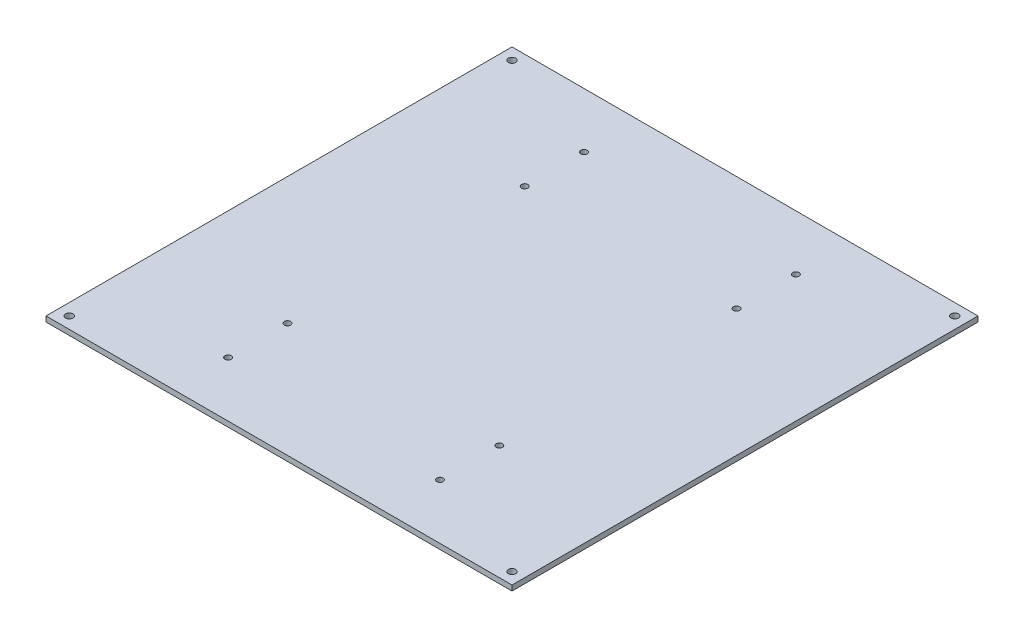
from build123d import *

# Parameters (mm, degrees)
SKETCH_1_W          = 220
SKETCH_1_H          = 220
SKETCH_1_R          = 1.75
EXTRUDE_1_DEPTH     = 2.5
SKETCH_2_R          = 1.5
CUT_EXTRUDE_1_DEPTH = 312.13702769


with BuildPart() as part:
    # 草图1 → 凸台-拉伸1 (new body)
    with BuildSketch(Plane(origin=(0, 0, 0), x_dir=(1, 0, 0), z_dir=(0, 1, 0))):
        with Locations((110, 110)):
            Rectangle(SKETCH_1_W, SKETCH_1_H)
        with Locations(Location((5.5, 5.5, 0), (0, 0, 270))):
            Circle(SKETCH_1_R, mode=Mode.SUBTRACT)
        with Locations(Location((214.5, 5.5, 0), (0, 0, 270))):
            Circle(SKETCH_1_R, mode=Mode.SUBTRACT)
        with Locations(Location((214.5, 214.5, 0), (0, 0, 270))):
            Circle(SKETCH_1_R, mode=Mode.SUBTRACT)
        with Locations(Location((5.5, 214.5, 0), (0, 0, 270))):
            Circle(SKETCH_1_R, mode=Mode.SUBTRACT)
    extrude(amount=EXTRUDE_1_DEPTH)

    # 草图2 → 切除-拉伸1 (cut, through all)
    with BuildSketch(Plane.XZ):
        with Locations(Location((60, -26, 0), (0, 0, 270))):
            Circle(SKETCH_2_R)
        with Locations(Location((60, -54, 0), (0, 0, 270))):
            Circle(SKETCH_2_R)
        with Locations(Location((60, -166, 0), (0, 0, 90))):
            Circle(SKETCH_2_R)
        with Locations(Location((60, -194, 0), (0, 0, 90))):
            Circle(SKETCH_2_R)
        with Locations(Location((160, -194, 0), (0, 0, 270))):
            Circle(SKETCH_2_R)
        with Locations(Location((160, -166, 0), (0, 0, 270))):
            Circle(SKETCH_2_R)
        with Locations(Location((160, -54, 0), (0, 0, 90))):
            Circle(SKETCH_2_R)
        with Locations(Location((160, -26, 0), (0, 0, 90))):
            Circle(SKETCH_2_R)
    extrude(amount=-CUT_EXTRUDE_1_DEPTH, mode=Mode.SUBTRACT)


solid = part.part
